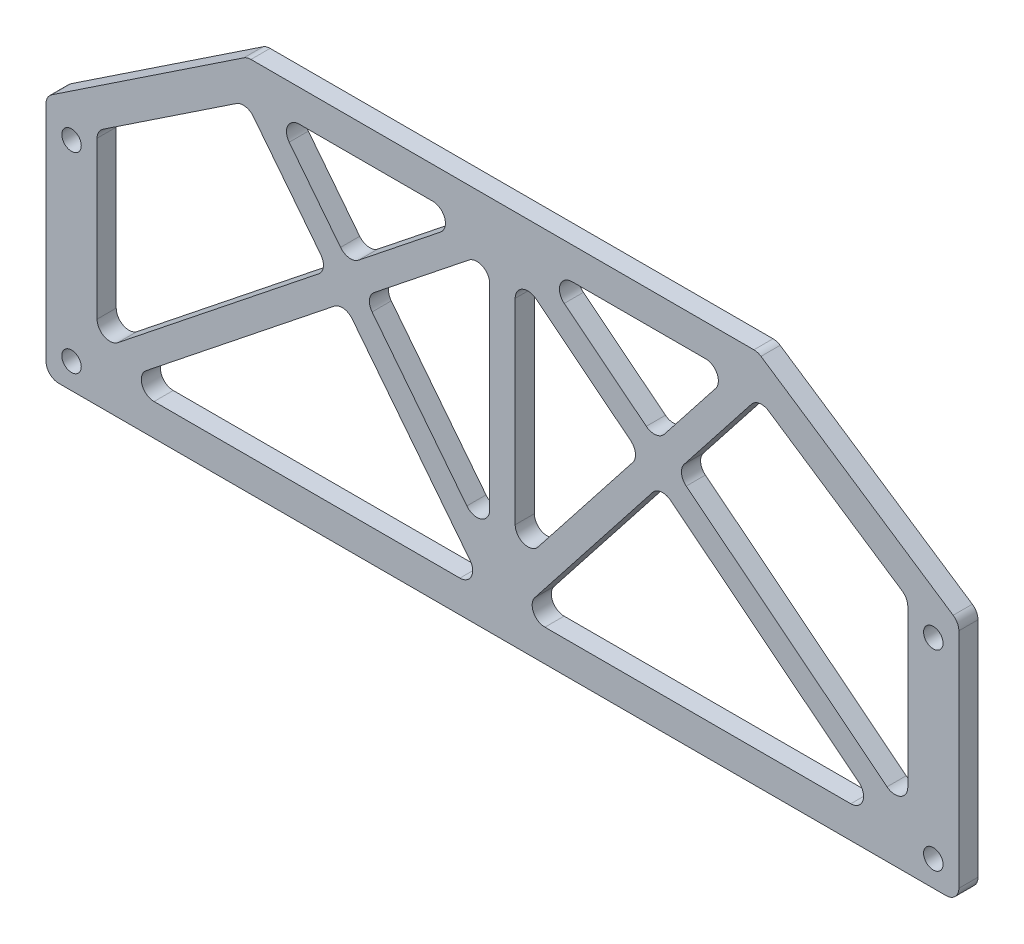
from build123d import *

# Parameters (mm, degrees)
SKETCH_1_R          = 1.525
EXTRUDE_1_DEPTH     = 1.5
FILLET_1_R          = 2
CUT_EXTRUDE_1_DEPTH = 11.5
EXTRUDE_2_DEPTH     = 3
FILLET_2_R          = 2


with BuildPart() as part:
    # 草图1 → 凸台-拉伸1 (new, symmetric)
    with BuildSketch(Plane.XY):
        Polygon((-71.5, 19), (-40, 40), (40, 40), (71.5, 19), (71.5, -19), (-71.5, -19), align=None)
        with Locations((67.5, 15)):
            Circle(SKETCH_1_R, mode=Mode.SUBTRACT)
        with Locations((67.5, -15)):
            Circle(SKETCH_1_R, mode=Mode.SUBTRACT)
        with Locations((-67.5, -15)):
            Circle(SKETCH_1_R, mode=Mode.SUBTRACT)
        with Locations((-67.5, 15)):
            Circle(SKETCH_1_R, mode=Mode.SUBTRACT)
    extrude(amount=EXTRUDE_1_DEPTH, both=True)

    # 圆角1
    fillet_1_edges = [part.edges().sort_by_distance(p)[0] for p in [
        (71.5, 19, 0),
        (71.5, -19, 0),
        (-71.5, -19, 0),
        (-71.5, 19, 0),
        (-40, 40, 0),
        (40, 40, 0),
    ]]
    fillet(fillet_1_edges, radius=FILLET_1_R)

    # 草图2 → 切除-拉伸1 (cut, symmetric)
    with BuildSketch(Plane.XY.offset(1.5)):
        Polygon((-2.543149186, -14), (-24.770935731, 14.300111558), (-60.290463502, -14), align=None)
        Polygon((-40.058974879, 33.764632352), (-38.486121811, 35), (-63.5, 18.324081208), (-63.5, -11.442808319), (-27.241730885, 17.445893903), align=None)
        Polygon((-5.209536498, 35), (-35.942972625, 35), (-24.113223205, 19.938526038), align=None)
        Polygon((-2, 32.442808319), (-21.642428051, 16.792743692), (-2, -8.215725055), align=None)
        Polygon((21.642428051, 16.792743692), (2, 32.442808319), (2, -8.215725055), align=None)
        Polygon((35.942972625, 35), (5.209536498, 35), (24.113223205, 19.938526038), align=None)
        Polygon((63.5, 18.324081208), (38.486121811, 35), (40.058974879, 33.764632352), (27.241730885, 17.445893903), (63.5, -11.442808319), align=None)
        Polygon((24.770935731, 14.300111558), (2.543149186, -14), (60.290463502, -14), align=None)
    extrude(amount=CUT_EXTRUDE_1_DEPTH, both=True, mode=Mode.SUBTRACT)

    # 草图3 → 凸台-拉伸2 (add)
    with BuildSketch(Plane.XY.offset(1.5)):
        Polygon((40.058974879, 33.764632352), (40.676658703, 34.551058886), (38.486121811, 35), align=None)
    extrude_2 = extrude(amount=-EXTRUDE_2_DEPTH)

    # 镜向1: 凸台-拉伸2 across plane
    add(extrude_2.mirror(Plane(origin=(0, 0, 0), x_dir=(0, 0, 1), z_dir=(1, 0, 0))))

    # 圆角2
    fillet_2_edges = [part.edges().sort_by_distance(p)[0] for p in [
        (2, 32.442808319, 0),
        (21.642428051, 16.792743692, 0),
        (2, -8.215725055, 0),
        (-21.642428051, 16.792743692, 0),
        (-2, 32.442808319, 0),
        (-2, -8.215725055, 0),
        (-63.5, -11.442808319, 0),
        (-63.5, 18.324081208, 0),
        (-27.241730885, 17.445893903, 0),
        (-24.113223205, 19.938526038, 0),
        (-35.942972625, 35, 0),
        (-5.209536498, 35, 0),
        (24.770935731, 14.300111558, 0),
        (60.290463502, -14, 0),
        (2.543149186, -14, 0),
        (5.209536498, 35, 0),
        (35.942972625, 35, 0),
        (24.113223205, 19.938526038, 0),
        (27.241730885, 17.445893903, 0),
        (63.5, 18.324081208, 0),
        (63.5, -11.442808319, 0),
        (-60.290463502, -14, 0),
        (-24.770935731, 14.300111558, 0),
        (-2.543149186, -14, 0),
        (40.155270293, 33.887234346, 0),
        (-40.155270293, 33.887234346, 0),
    ]]
    fillet(fillet_2_edges, radius=FILLET_2_R)


solid = part.part
